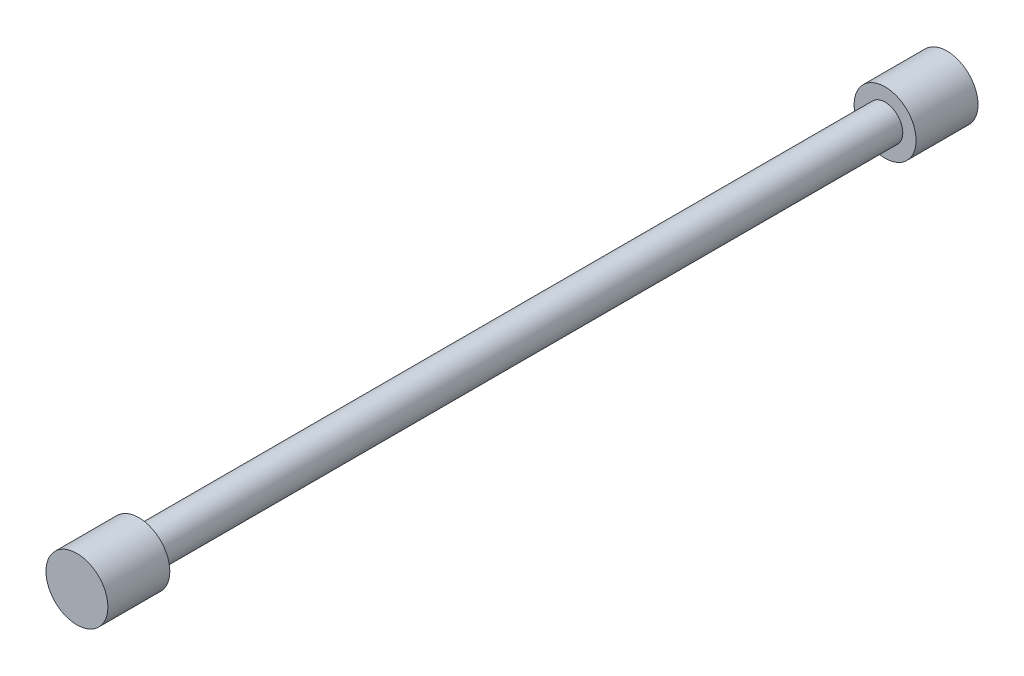
from build123d import *


with BuildPart() as part:
    # SK_Rod → Rod_Body (revolve)
    with BuildSketch(Plane(origin=(0, 0, 0), x_dir=(1, 0, 0), z_dir=(0, 1, 0))):
        Polygon((0, -7), (7, -7), (7, 7), (4, 7), (4, 175.66909974), (7, 175.66909974), (7, 189.66909974), (0, 189.66909974), align=None)
    revolve(axis=Axis((0, 0, 10), (0, 0, -1)))


solid = part.part
